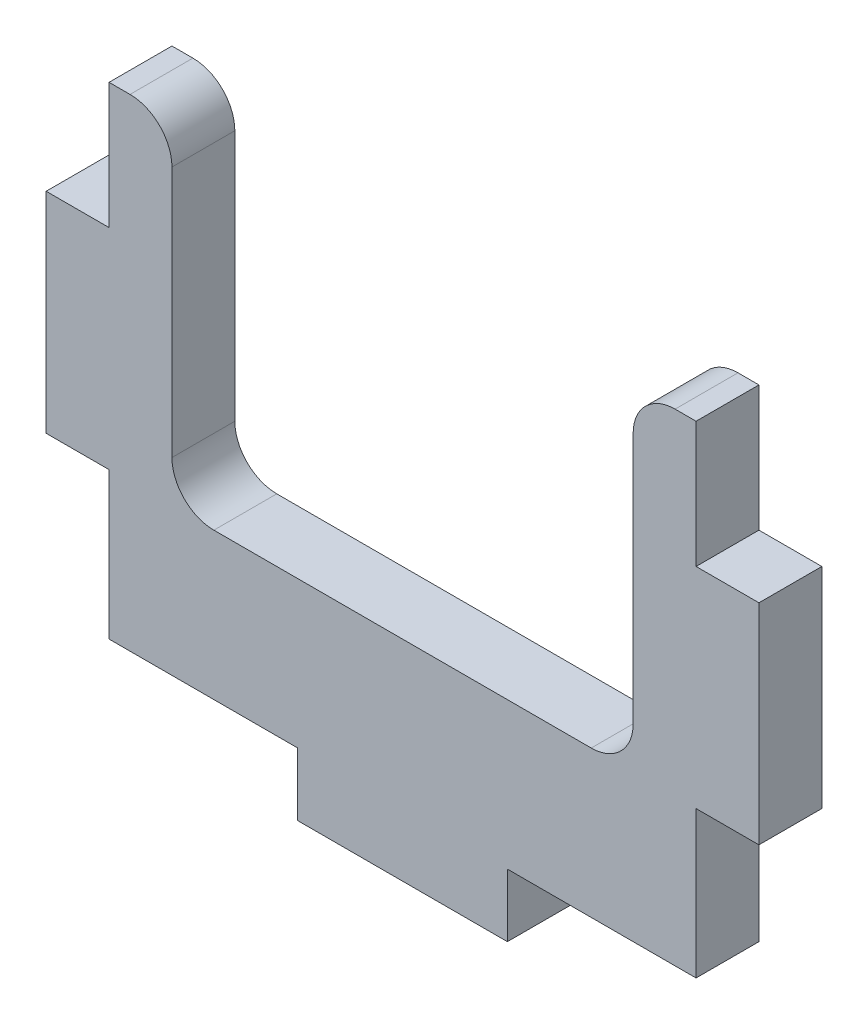
from build123d import *

# Parameters (mm, degrees)
SKETCH_1_W               = 28
SKETCH_1_H               = 24
SKETCH_1_W_2             = 3
SKETCH_1_H_2             = 10
SKETCH_1_W_3             = 10
SKETCH_1_H_3             = 3
EXTRUDE_1_DEPTH          = 3
SKETCH_3_W               = 28
SKETCH_3_H               = 1
CUT_EXTRUDE_2_DEPTH      = 3
CUT_EXTRUDE_3_DEPTH      = 23.869193252
CUT_EXTRUDE_3_DEPTH_BACK = 23.869193252
SKETCH_4_W               = 22
SKETCH_4_H               = 16
FILLET_1_R               = 2


with BuildPart() as part:
    # 草图1 → 凸台-拉伸1 (new body)
    with BuildSketch(Plane.XY):
        Rectangle(SKETCH_1_W, SKETCH_1_H)
        with Locations((-15.5, 0)):
            Rectangle(SKETCH_1_W_2, SKETCH_1_H_2)
        with Locations((15.5, 0)):
            Rectangle(SKETCH_1_W_2, SKETCH_1_H_2)
        with Locations((0, -13.5)):
            Rectangle(SKETCH_1_W_3, SKETCH_1_H_3)
    extrude(amount=EXTRUDE_1_DEPTH)

    # 草图3 → 切除-拉伸2 (cut)
    with BuildSketch(Plane.XY.offset(3)):
        with Locations((0, 11.5)):
            Rectangle(SKETCH_3_W, SKETCH_3_H)
    extrude(amount=-CUT_EXTRUDE_2_DEPTH, mode=Mode.SUBTRACT)

    # 草图4 → 切除-拉伸3 (cut, two sides: drawn at the far end of the back side and taken through both)
    with BuildSketch(Plane.XY.offset(3).offset(-CUT_EXTRUDE_3_DEPTH_BACK)):
        with Locations((0, 3)):
            Rectangle(SKETCH_4_W, SKETCH_4_H)
    extrude(amount=CUT_EXTRUDE_3_DEPTH + CUT_EXTRUDE_3_DEPTH_BACK, mode=Mode.SUBTRACT)

    # 圆角1
    fillet_1_edges = [part.edges().sort_by_distance(p)[0] for p in [
        (-11, -5, 1.5),
        (-11, 11, 1.5),
        (11, 11, 1.5),
        (11, -5, 1.5),
    ]]
    fillet(fillet_1_edges, radius=FILLET_1_R)


solid = part.part
